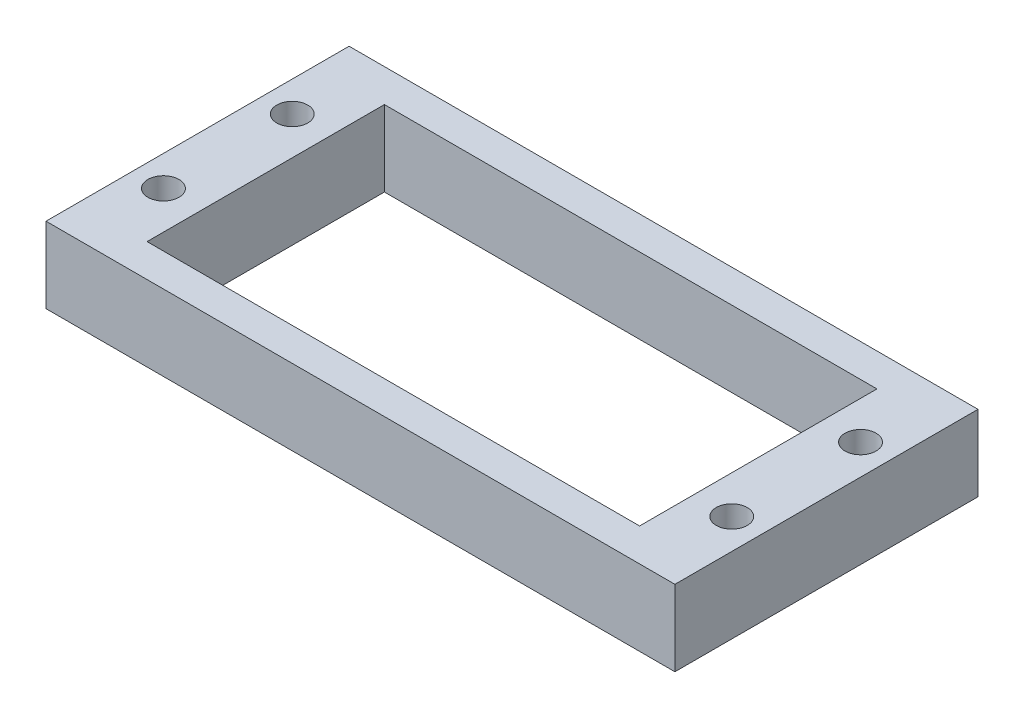
from build123d import *

# Parameters (mm, degrees)
SKETCH1_W           = 83
SKETCH1_H           = 40
SKETCH1_R           = 2.05
SKETCH1_W_2         = 65
SKETCH1_H_2         = 31.325301204
BOSS_EXTRUDE1_DEPTH = 10


with BuildPart() as part:
    # Sketch1 → Boss-Extrude1 (new body)
    with BuildSketch(Plane(origin=(0, 0, 0), x_dir=(1, 0, 0), z_dir=(0, 1, 0))):
        Rectangle(SKETCH1_W, SKETCH1_H)
        with Locations(Location((-37.5, 8.5, 0), (0, 0, 270))):
            Circle(SKETCH1_R, mode=Mode.SUBTRACT)
        with Locations(Location((-37.5, -8.5, 0), (0, 0, 270))):
            Circle(SKETCH1_R, mode=Mode.SUBTRACT)
        with Locations(Location((37.5, -8.5, 0), (0, 0, 270))):
            Circle(SKETCH1_R, mode=Mode.SUBTRACT)
        with Locations(Location((37.5, 8.5, 0), (0, 0, 270))):
            Circle(SKETCH1_R, mode=Mode.SUBTRACT)
        Rectangle(SKETCH1_W_2, SKETCH1_H_2, mode=Mode.SUBTRACT)
    extrude(amount=BOSS_EXTRUDE1_DEPTH)


solid = part.part
